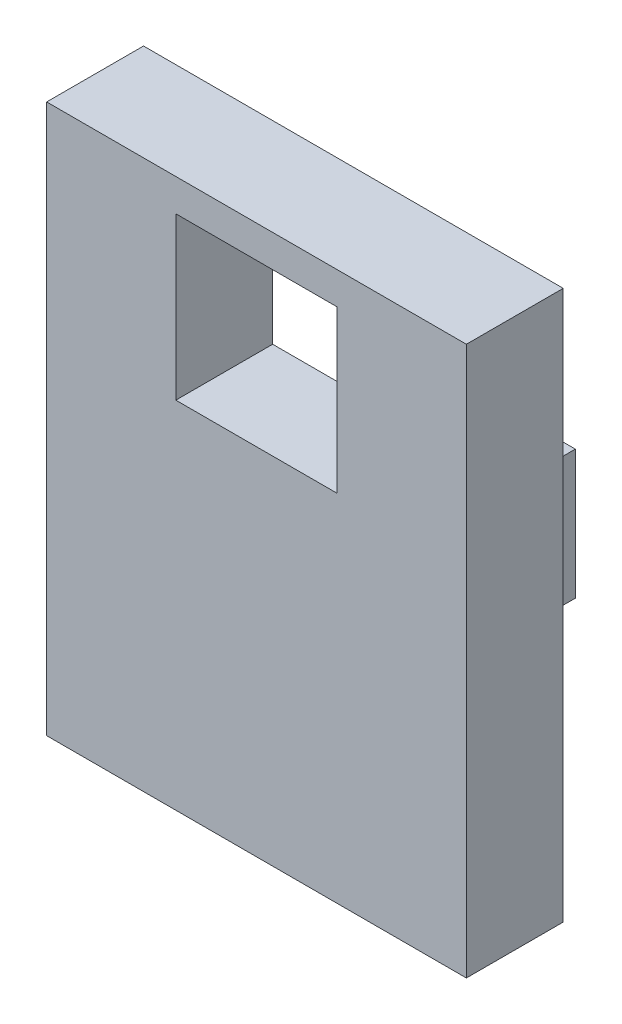
from build123d import *

# Parameters (mm, degrees)
SKETCH1_W           = 41.275
SKETCH1_H           = 53.975
SKETCH1_W_2         = 15.875
SKETCH1_H_2         = 15.875
BOSS_EXTRUDE1_DEPTH = 9.525
SKETCH2_W           = 12.7
SKETCH2_H           = 12.7
BOSS_EXTRUDE2_DEPTH = 15.477083255


with BuildPart() as part:
    # Sketch1 → Boss-Extrude1 (new body)
    with BuildSketch(Plane.XY):
        with Locations((-6.943541269, -10.118279033)):
            Rectangle(SKETCH1_W, SKETCH1_H)
        with Locations((-6.943541269, 5.756720967)):
            Rectangle(SKETCH1_W_2, SKETCH1_H_2, mode=Mode.SUBTRACT)
    extrude(amount=-BOSS_EXTRUDE1_DEPTH)

    # Sketch2 → Boss-Extrude2 (add)
    with BuildSketch(Plane(origin=(0, 0, -9.525), x_dir=(-1, 0, 0), z_dir=(0, 0, -1))):
        with Locations((6.943541269, -18.055779033)):
            Rectangle(SKETCH2_W, SKETCH2_H)
    extrude(amount=BOSS_EXTRUDE2_DEPTH)


solid = part.part
